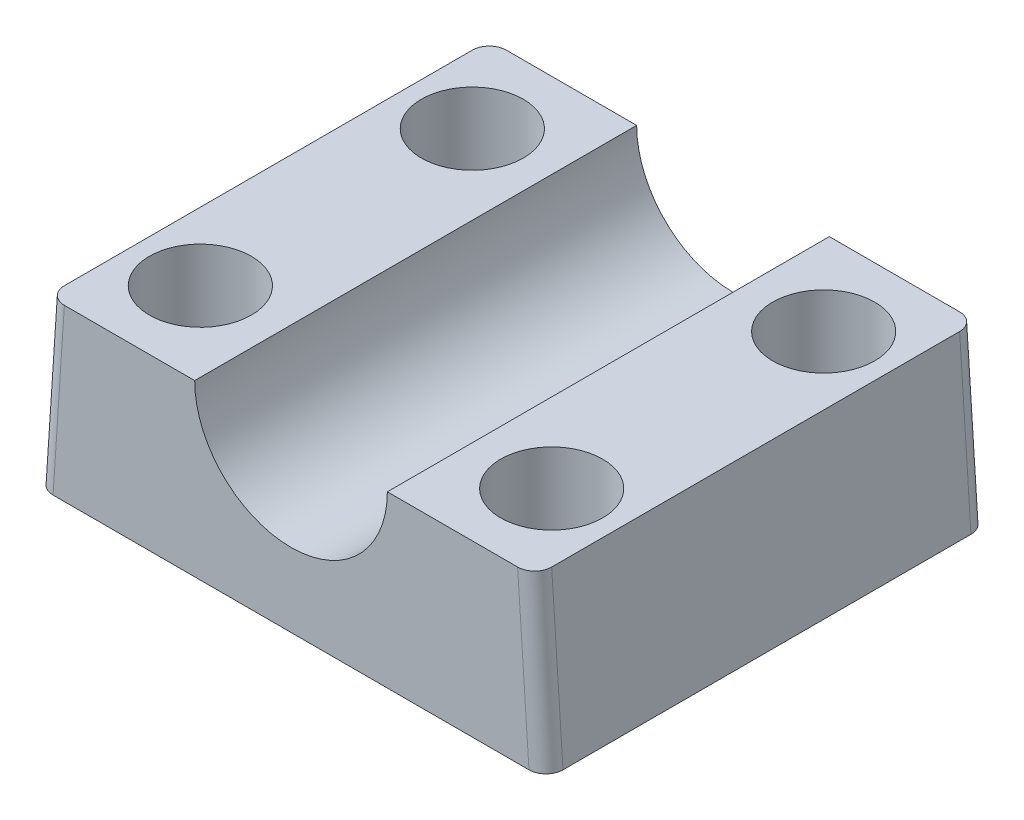
from build123d import *

# Parameters (mm, degrees)
ESTRUSIONE_ESTRUSIONE1_DEPTH = 39
FORO_PER_VITE_M8_1_D         = 9
FORO_PER_VITE_M8_1_DEPTH     = 30
FORO_PER_VITE_M8_1_TIP       = 2.703872786
RACCORDO1_R                  = 1.5


with BuildPart() as part:
    # Schizzo1 → Estrusione-Estrusione1 (new body)
    with BuildSketch(Plane.XY):
        with BuildLine():
            Line((-8.5, 15), (-21.5, 15))
            Line((-21.5, 15), (-22.5, 0))
            Line((-22.5, 0), (22.5, 0))
            Line((22.5, 0), (21.5, 15))
            Line((21.5, 15), (8.5, 15))
            ThreePointArc((8.5, 15), (0, 6.5), (-8.5, 15))
        make_face()
    extrude(amount=ESTRUSIONE_ESTRUSIONE1_DEPTH)

    # Foro per Vite M8-1
    with Locations(Plane(origin=(0, 0, 0), x_dir=(-1, 0, 0), z_dir=(0, -1, 0))):
        with Locations((-15.5, -7.5), (15.5, -7.5), (15.5, -31.5), (-15.5, -31.5)):
            Hole(FORO_PER_VITE_M8_1_D / 2, depth=FORO_PER_VITE_M8_1_DEPTH)
            with Locations((0, 0, -(FORO_PER_VITE_M8_1_DEPTH + FORO_PER_VITE_M8_1_TIP / 2))):  # 118° drill point
                Cone(0, FORO_PER_VITE_M8_1_D / 2, FORO_PER_VITE_M8_1_TIP, mode=Mode.SUBTRACT)

    # Raccordo1
    raccordo1_edges = [part.edges().sort_by_distance(p)[0] for p in [
        (-22, 7.5, 39),
        (22, 7.5, 39),
        (22, 7.5, 0),
        (-22, 7.5, 0),
    ]]
    fillet(raccordo1_edges, radius=RACCORDO1_R)


solid = part.part
